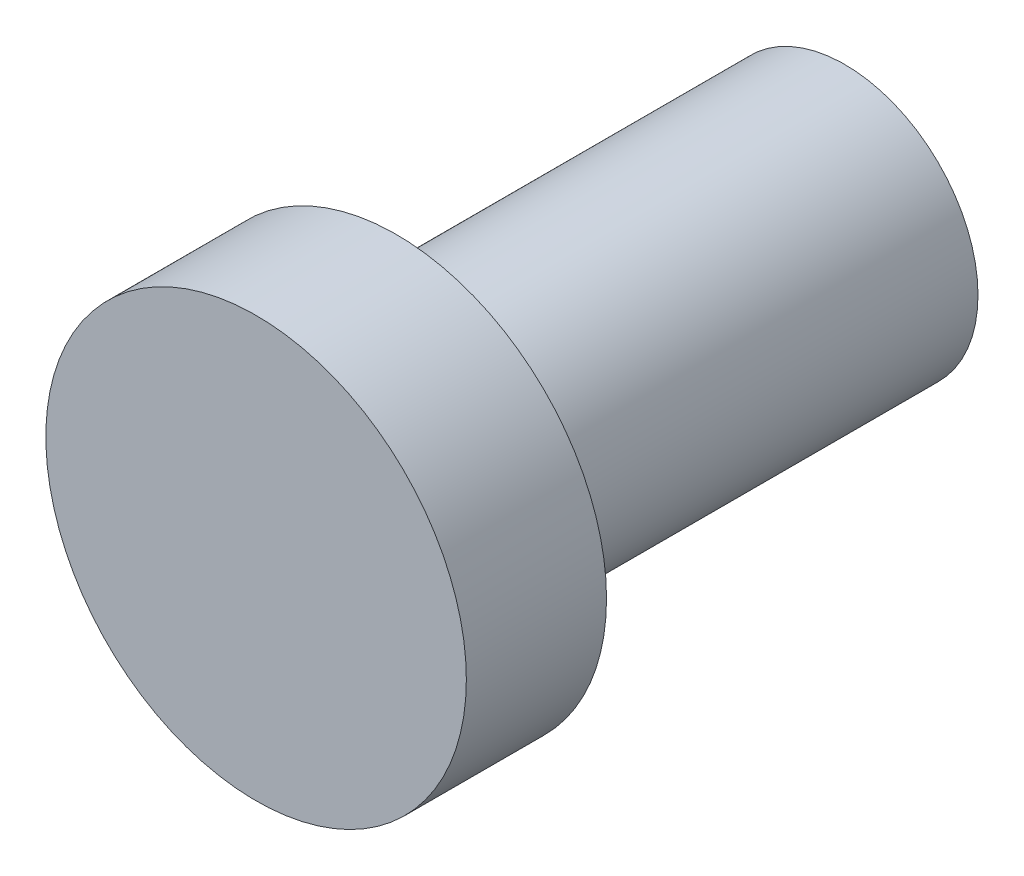
from build123d import *

# Parameters (mm, degrees)
SKETCH1_R           = 4.75
BOSS_EXTRUDE1_DEPTH = 16
SKETCH2_R           = 7.5
BOSS_EXTRUDE2_DEPTH = 5
SKETCH3_R           = 3.5
CUT_EXTRUDE1_DEPTH  = 12
CUT_EXTRUDE1_DRAFT  = -6


with BuildPart() as part:
    # Sketch1 → Boss-Extrude1 (new body)
    with BuildSketch(Plane.XY):
        Circle(SKETCH1_R)
    extrude(amount=BOSS_EXTRUDE1_DEPTH)

    # Sketch2 → Boss-Extrude2 (add)
    with BuildSketch(Plane.XY.offset(16)):
        Circle(SKETCH2_R)
    extrude(amount=BOSS_EXTRUDE2_DEPTH)


with BuildPart() as cut_extrude1_tool:
    # Sketch3 → Cut-Extrude1 (with draft: the straight prism first)
    with BuildSketch(Plane(origin=(0, 0, 0), x_dir=(-1, 0, 0), z_dir=(0, 0, -1))):
        Circle(SKETCH3_R)
    extrude(amount=-CUT_EXTRUDE1_DEPTH)
    # Cut-Extrude1: the draft: its side faces are tilted about the plane it starts from
    cut_extrude1_sides = [cut_extrude1_tool.faces().sort_by_distance(p)[0] for p in [
        (3.5, 0, 6),
    ]]
    draft(cut_extrude1_sides, Plane(origin=(0, 0, 0), x_dir=(-1, 0, 0), z_dir=(0, 0, -1)), CUT_EXTRUDE1_DRAFT)


with BuildPart() as part_1:
    add(part.part)

    # Cut-Extrude1: cut by cut_extrude1_tool
    add(cut_extrude1_tool.part, mode=Mode.SUBTRACT)


solid = part_1.part
